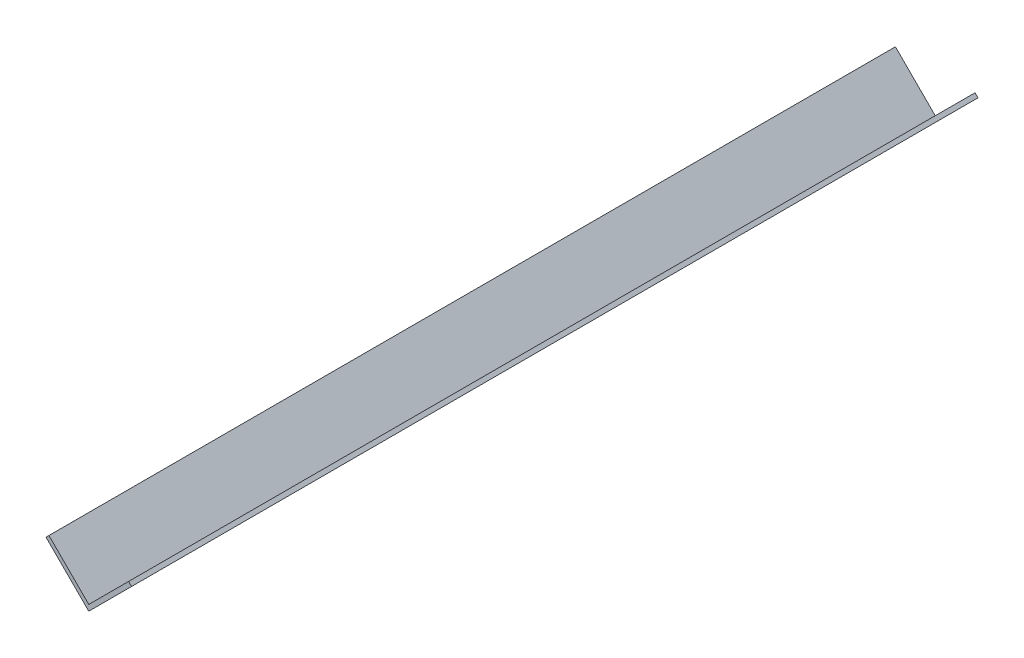
from build123d import *

# Parameters (mm, degrees)
BOSS_EXTRUDE1_DEPTH = 355.6


with BuildPart() as part:
    # Sketch1 → Boss-Extrude1 (new body)
    with BuildSketch(Plane.XY):
        Polygon((0, 0), (-17.960512242, 17.960512242), (-16.725727025, 19.195297459), (0, 2.469570433), (16.725727025, 19.195297459), (17.960512242, 17.960512242), align=None)
    extrude(amount=BOSS_EXTRUDE1_DEPTH)


solid = part.part
